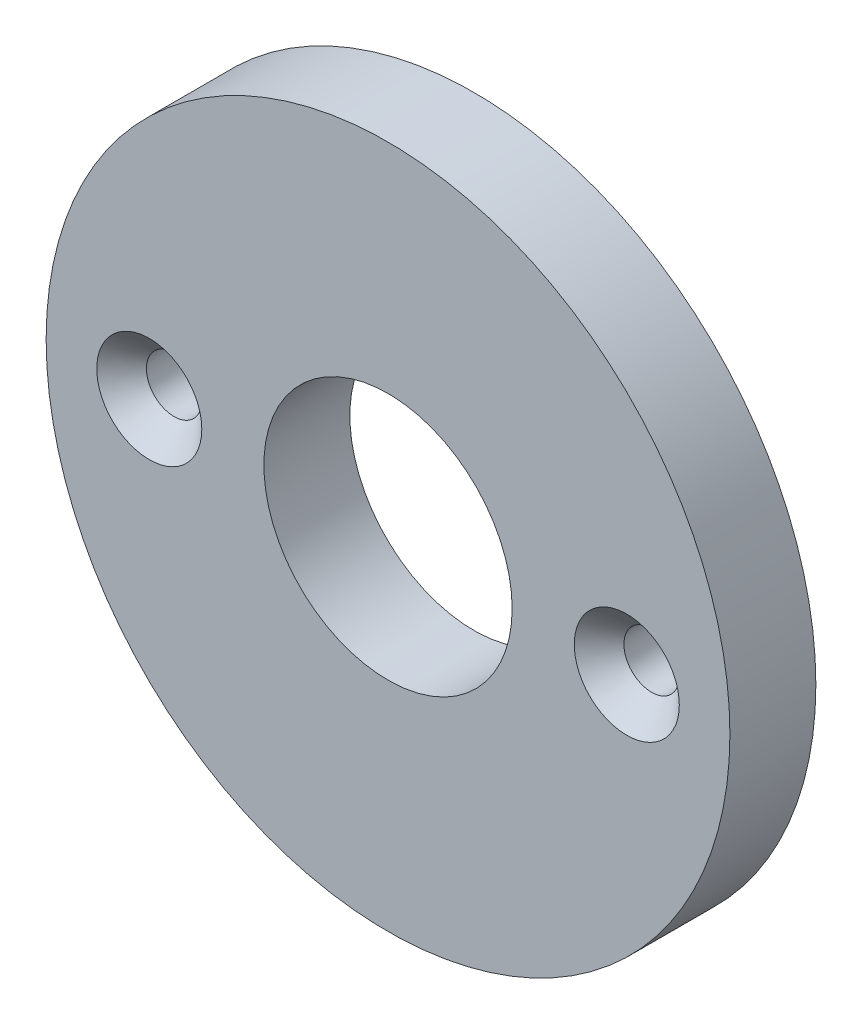
from build123d import *

# Parameters (mm, degrees)
SKETCH1_R                                         = 17.9
SKETCH1_R_2                                       = 6.5
BOSS_EXTRUDE1_DEPTH                               = 4.5
CSK_FOR_M2_5_FLAT_HEAD_MACHINE_SCREW2_D           = 2.9
CSK_FOR_M2_5_FLAT_HEAD_MACHINE_SCREW2_DEPTH       = 4.5
CSK_FOR_M2_5_FLAT_HEAD_MACHINE_SCREW2_CSINK_D     = 5.5
CSK_FOR_M2_5_FLAT_HEAD_MACHINE_SCREW2_CSINK_ANGLE = 90
CSK_FOR_M2_5_FLAT_HEAD_MACHINE_SCREW2_TIP         = 0.871247898


with BuildPart() as part:
    # Sketch1 → Boss-Extrude1 (new body)
    with BuildSketch(Plane.XY):
        Circle(SKETCH1_R)
        Circle(SKETCH1_R_2, mode=Mode.SUBTRACT)
    extrude(amount=BOSS_EXTRUDE1_DEPTH)

    # CSK for M2.5 Flat Head Machine Screw2
    with Locations(Plane.XY.offset(4.5)):
        with Locations((-12.5, 0), (12.5, 0)):
            CounterSinkHole(CSK_FOR_M2_5_FLAT_HEAD_MACHINE_SCREW2_D / 2, CSK_FOR_M2_5_FLAT_HEAD_MACHINE_SCREW2_CSINK_D / 2, depth=CSK_FOR_M2_5_FLAT_HEAD_MACHINE_SCREW2_DEPTH, counter_sink_angle=CSK_FOR_M2_5_FLAT_HEAD_MACHINE_SCREW2_CSINK_ANGLE)
            with Locations((0, 0, -(CSK_FOR_M2_5_FLAT_HEAD_MACHINE_SCREW2_DEPTH + CSK_FOR_M2_5_FLAT_HEAD_MACHINE_SCREW2_TIP / 2))):  # 118° drill point
                Cone(0, CSK_FOR_M2_5_FLAT_HEAD_MACHINE_SCREW2_D / 2, CSK_FOR_M2_5_FLAT_HEAD_MACHINE_SCREW2_TIP, mode=Mode.SUBTRACT)


solid = part.part
